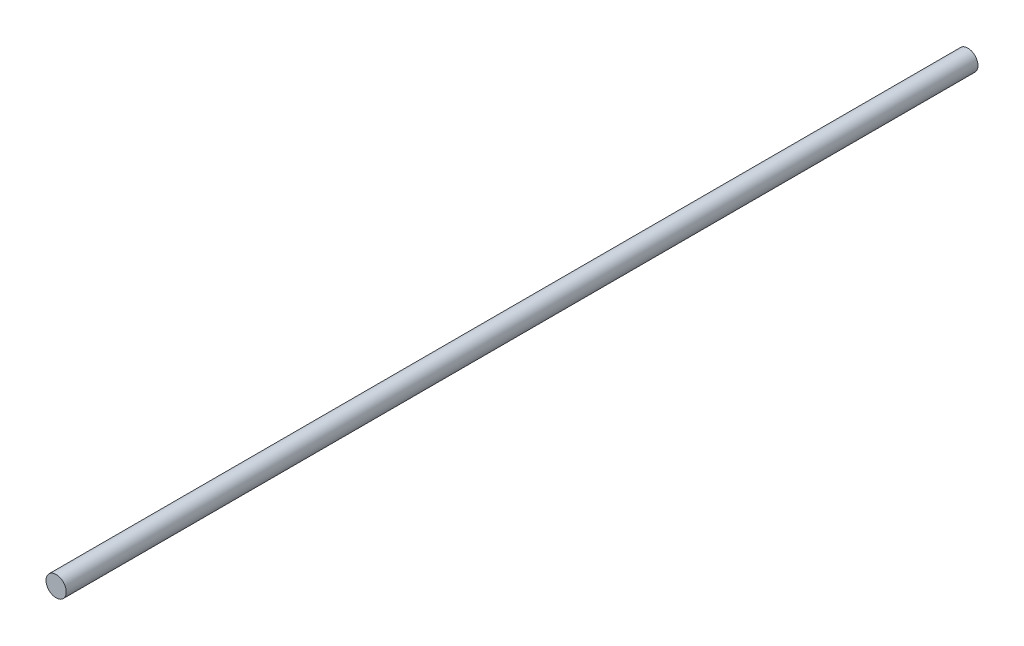
from build123d import *

# Parameters (mm, degrees)
SKETCH1_R           = 2.5
BOSS_EXTRUDE1_DEPTH = 225


with BuildPart() as part:
    # Sketch1 → Boss-Extrude1 (new body)
    with BuildSketch(Plane.XY):
        Circle(SKETCH1_R)
    extrude(amount=BOSS_EXTRUDE1_DEPTH)


solid = part.part
